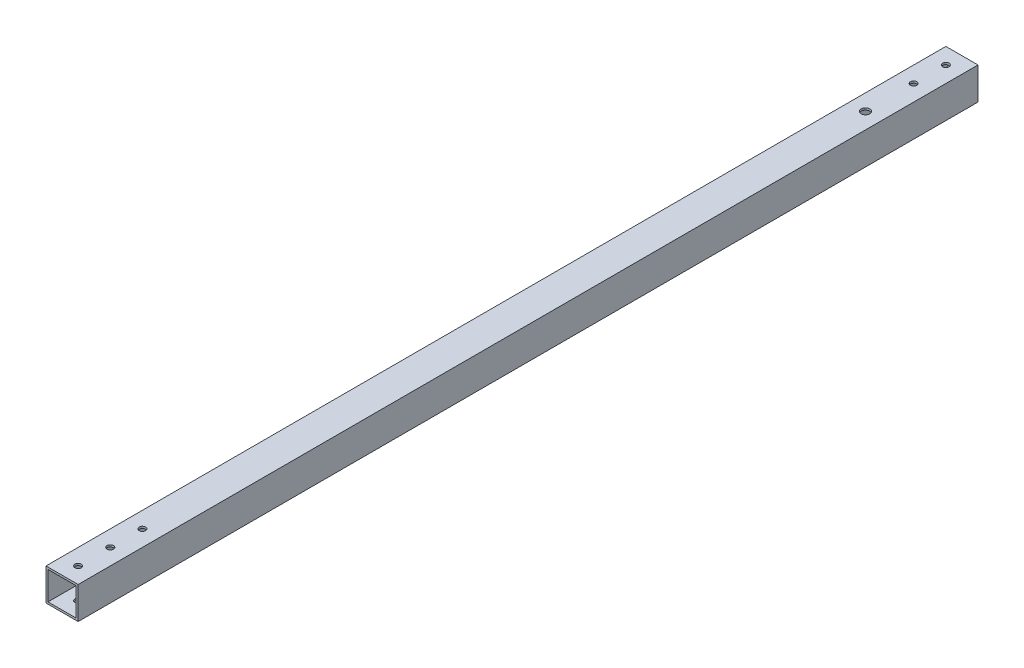
from build123d import *

# Parameters (mm, degrees)
SKETCH1_W           = 25.4
SKETCH1_H           = 25.4
SKETCH1_W_2         = 22.225
SKETCH1_H_2         = 22.225
BOSS_EXTRUDE1_DEPTH = 711.2
SKETCH3_R           = 2.54
SKETCH3_R_2         = 3.429
CUT_EXTRUDE2_DEPTH  = 713.106565059


with BuildPart() as part:
    # Sketch1 → Boss-Extrude1 (new body)
    with BuildSketch(Plane.XY):
        with Locations((12.7, 12.7)):
            Rectangle(SKETCH1_W, SKETCH1_H)
        with Locations((12.7, 12.7)):
            Rectangle(SKETCH1_W_2, SKETCH1_H_2, mode=Mode.SUBTRACT)
    extrude(amount=BOSS_EXTRUDE1_DEPTH)

    # Sketch3 → Cut-Extrude2 (cut, through all)
    with BuildSketch(Plane(origin=(0, 25.4, 0), x_dir=(1, 0, 0), z_dir=(0, 1, 0))):
        with Locations(Location((12.7, -12.7, 0), (0, 0, 270))):
            Circle(SKETCH3_R)
        with Locations(Location((12.7, -698.5, 0), (0, 0, 270))):
            Circle(SKETCH3_R)
        with Locations(Location((12.7, -38.1, 0), (0, 0, 270))):
            Circle(SKETCH3_R)
        with Locations(Location((12.7, -673.1, 0), (0, 0, 270))):
            Circle(SKETCH3_R)
        with Locations(Location((12.7, -647.7, 0), (0, 0, 270))):
            Circle(SKETCH3_R)
        with Locations(Location((12.7, -76.2, 0), (0, 0, 270))):
            Circle(SKETCH3_R_2)
    extrude(amount=-CUT_EXTRUDE2_DEPTH, mode=Mode.SUBTRACT)


solid = part.part
